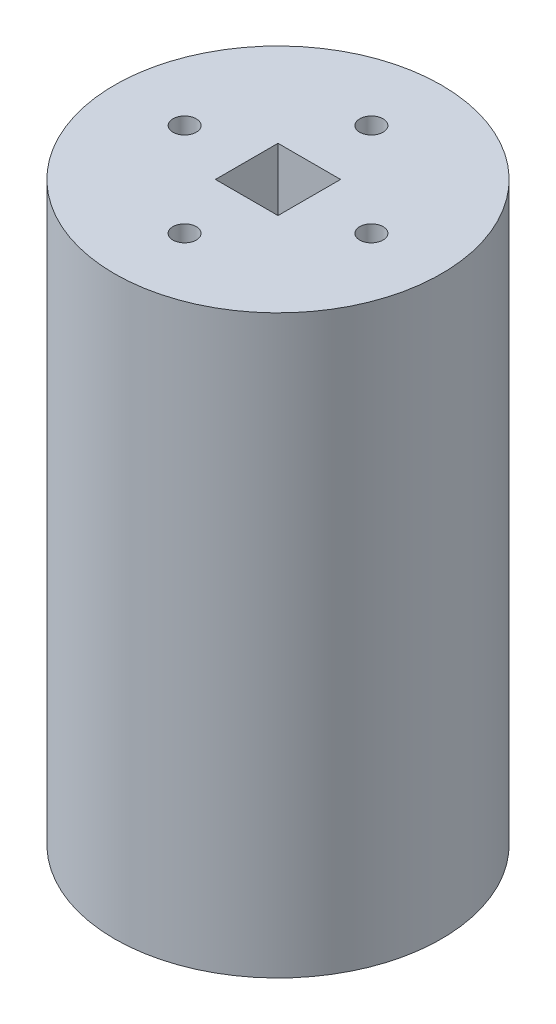
from build123d import *

# Parameters (mm, degrees)
SKETCH1_W                   = 6.7
SKETCH1_H                   = 6.7
BOSS_EXTRUDE1_DEPTH         = 61.675
TAP_DRILL_FOR_M3X0_5_TAP1_D = 2.5


with BuildPart() as part:
    # Sketch1 → Boss-Extrude1 (new body)
    # profile 1 of 2: a face of its own
    with BuildSketch(Plane(origin=(0, 0, 0), x_dir=(1, 0, 0), z_dir=(0, 1, 0))):
        with BuildLine():
            ThreePointArc((0, -17.5), (12.374368671, -12.374368671), (17.5, 0))
            ThreePointArc((17.5, 0), (7.362522242, -7.362522242), (0, -17.5))
        make_face()
    # profile 2 of 2: a face of its own
    with BuildSketch(Plane(origin=(0, 0, 0), x_dir=(1, 0, 0), z_dir=(0, 1, 0))):
        with BuildLine():
            ThreePointArc((0, -17.5), (7.362522242, -7.362522242), (17.5, 0))
            ThreePointArc((17.5, 0), (-12.374368671, 12.374368671), (0, -17.5))
        make_face()
        Rectangle(SKETCH1_W, SKETCH1_H, mode=Mode.SUBTRACT)
    extrude(amount=-BOSS_EXTRUDE1_DEPTH)

    # Tap Drill for M3x0.5 Tap1 (through all)
    with Locations(Plane(origin=(0, 0, -10), x_dir=(0, 0, 1), z_dir=(0, 1, 0))):
        with Locations((0, 0), (10, 10), (10, -10), (20, 0)):
            Hole(TAP_DRILL_FOR_M3X0_5_TAP1_D / 2)


solid = part.part
